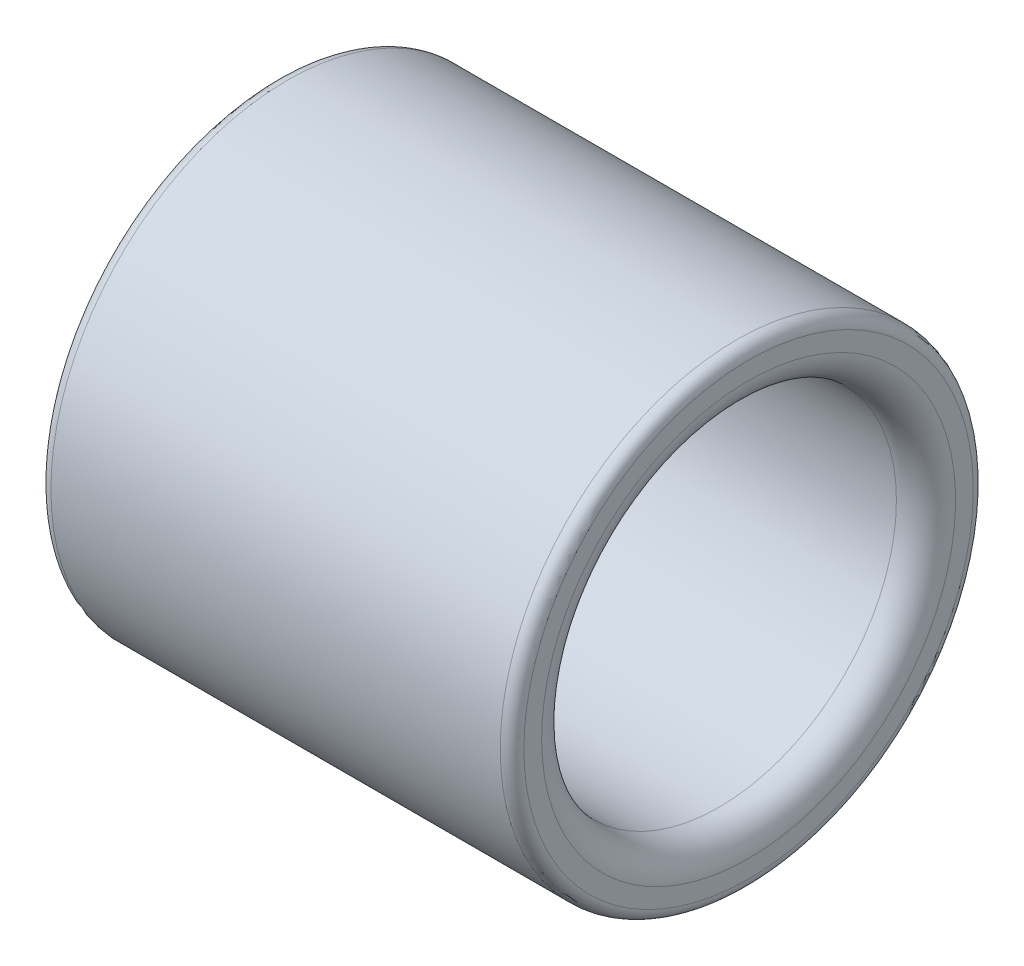
from build123d import *

# Parameters (mm, degrees)
SKETCH1_W = 8
SKETCH1_H = 1
FILLET2_R = 0.2
FILLET3_R = 0.5


with BuildPart() as part:
    # Sketch1 → Revolve1 (revolve)
    with BuildSketch(Plane.XY):
        with Locations((4, 3.5)):
            Rectangle(SKETCH1_W, SKETCH1_H)
    revolve(axis=Axis((0, 0, 0), (1, 0, 0)))

    # Fillet2
    fillet2_edges = [part.edges().sort_by_distance(p)[0] for p in [
        (8, -4, 0),
        (0, -4, 0),
    ]]
    fillet(fillet2_edges, radius=FILLET2_R)

    # Fillet3
    fillet3_edges = [part.edges().sort_by_distance(p)[0] for p in [
        (8, -3, 0),
        (0, -3, 0),
    ]]
    fillet(fillet3_edges, radius=FILLET3_R)


solid = part.part
